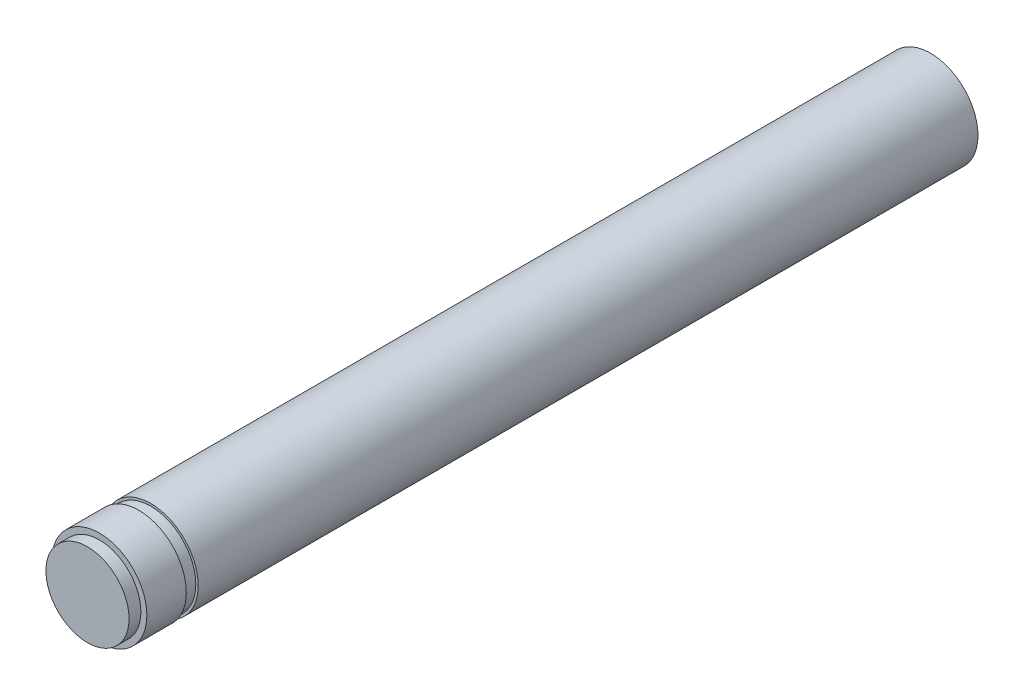
from build123d import *


with BuildPart() as part:
    # Sketch2 → Revolve1 (revolve)
    with BuildSketch(Plane(origin=(0, 0, 0), x_dir=(1, 0, 0), z_dir=(0, 1, 0))):
        Polygon((0, 0), (0, -70), (0, -71), (3.5, -71), (3.5, -70), (4, -70), (4, -66.6762), (3.8, -66.6762), (3.8, -65.6762), (4, -65.6762), (4, 0), align=None)
    revolve(axis=Axis((0, 0, 25.914367816), (0, 0, -1)))


solid = part.part
